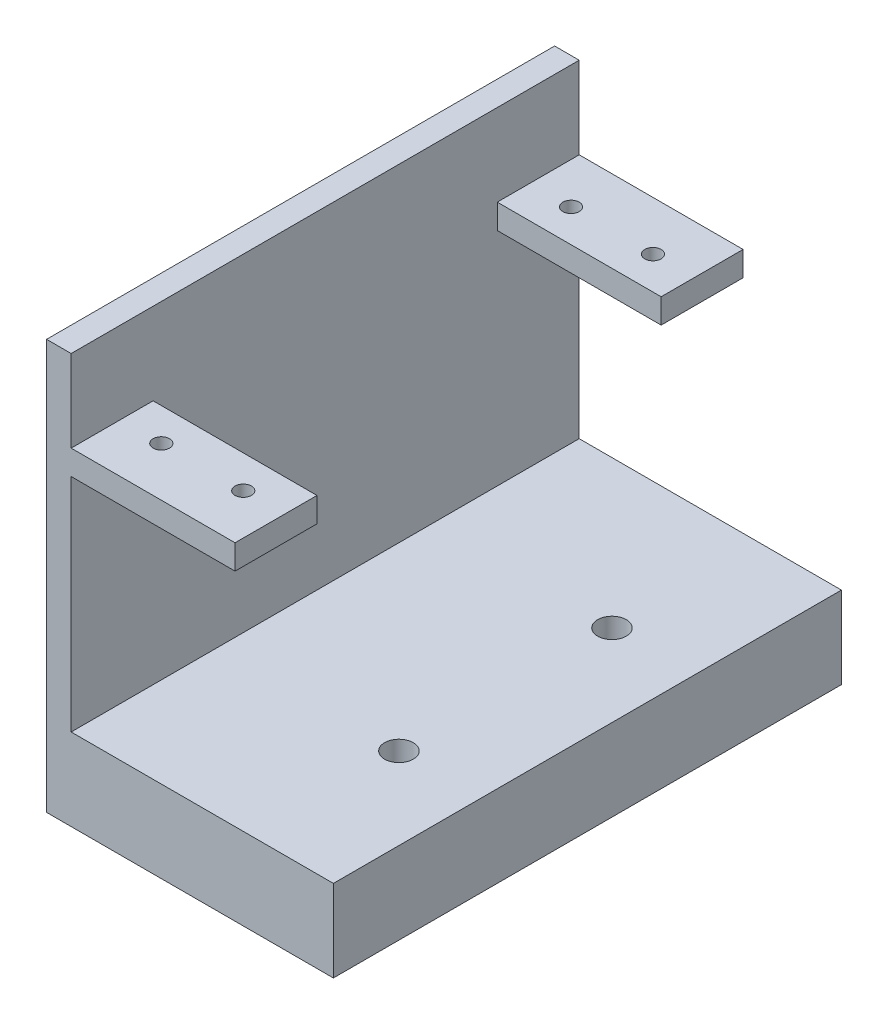
from build123d import *

# Parameters (mm, degrees)
SKETCH_1_W                = 50
SKETCH_1_H                = 62
EXTRUDE_1_DEPTH           = 35
SKETCH_2_W                = 32
SKETCH_2_H                = 40
CUT_EXTRUDE_1_DEPTH       = 88
SKETCH_3_W                = 10
SKETCH_3_H                = 3
EXTRUDE_2_DEPTH           = 20
SKETCH_4_W                = 10
SKETCH_4_H                = 3
EXTRUDE_3_DEPTH           = 20
HOLE_WIZARD_2_0_2_1_D     = 2
HOLE_WIZARD_2_0_2_1_DEPTH = 13
HOLE_WIZARD_3_5_3_5_1_D   = 3.5


with BuildPart() as part:
    # 草图1 → 凸台-拉伸1 (new body)
    with BuildSketch(Plane(origin=(0, 0, 0), x_dir=(0, -1, 0), z_dir=(-1, 0, 0))):
        with Locations((-25, 31)):
            Rectangle(SKETCH_1_W, SKETCH_1_H)
    extrude(amount=-EXTRUDE_1_DEPTH)

    # 草图2 → 切除-拉伸1 (cut, through all)
    with BuildSketch(Plane(origin=(0, 0, 0), x_dir=(-1, 0, 0), z_dir=(0, 0, -1))):
        with Locations((-19, 30)):
            Rectangle(SKETCH_2_W, SKETCH_2_H)
    extrude(amount=-CUT_EXTRUDE_1_DEPTH, mode=Mode.SUBTRACT)

    # 草图3 → 凸台-拉伸2 (add)
    with BuildSketch(Plane(origin=(3, 0, 0), x_dir=(0, 0, -1), z_dir=(1, 0, 0))):
        with Locations((-5, 38.5)):
            Rectangle(SKETCH_3_W, SKETCH_3_H)
    extrude(amount=EXTRUDE_2_DEPTH)

    # 草图4 → 凸台-拉伸3 (add)
    with BuildSketch(Plane(origin=(3, 0, 0), x_dir=(0, 0, -1), z_dir=(1, 0, 0))):
        with Locations((-57, 38.5)):
            Rectangle(SKETCH_4_W, SKETCH_4_H)
    extrude(amount=EXTRUDE_3_DEPTH)

    # Ø2.0 (2) 直径孔1
    with Locations(Plane(origin=(0, 37, 0), x_dir=(-1, 0, 0), z_dir=(0, -1, 0))):
        with Locations((-8, -6.00000059), (-18, -6.00000059), (-8, -55.99999941), (-18, -55.99999941)):
            Hole(HOLE_WIZARD_2_0_2_1_D / 2, depth=HOLE_WIZARD_2_0_2_1_DEPTH)

    # Ø3.5 (3.5) 直径孔1 (through all)
    with Locations(Plane(origin=(0, 10, 0), x_dir=(1, 0, 0), z_dir=(0, 1, 0))):
        with Locations((24.999999565, -18), (24.999999565, -44)):
            Hole(HOLE_WIZARD_3_5_3_5_1_D / 2)


solid = part.part
